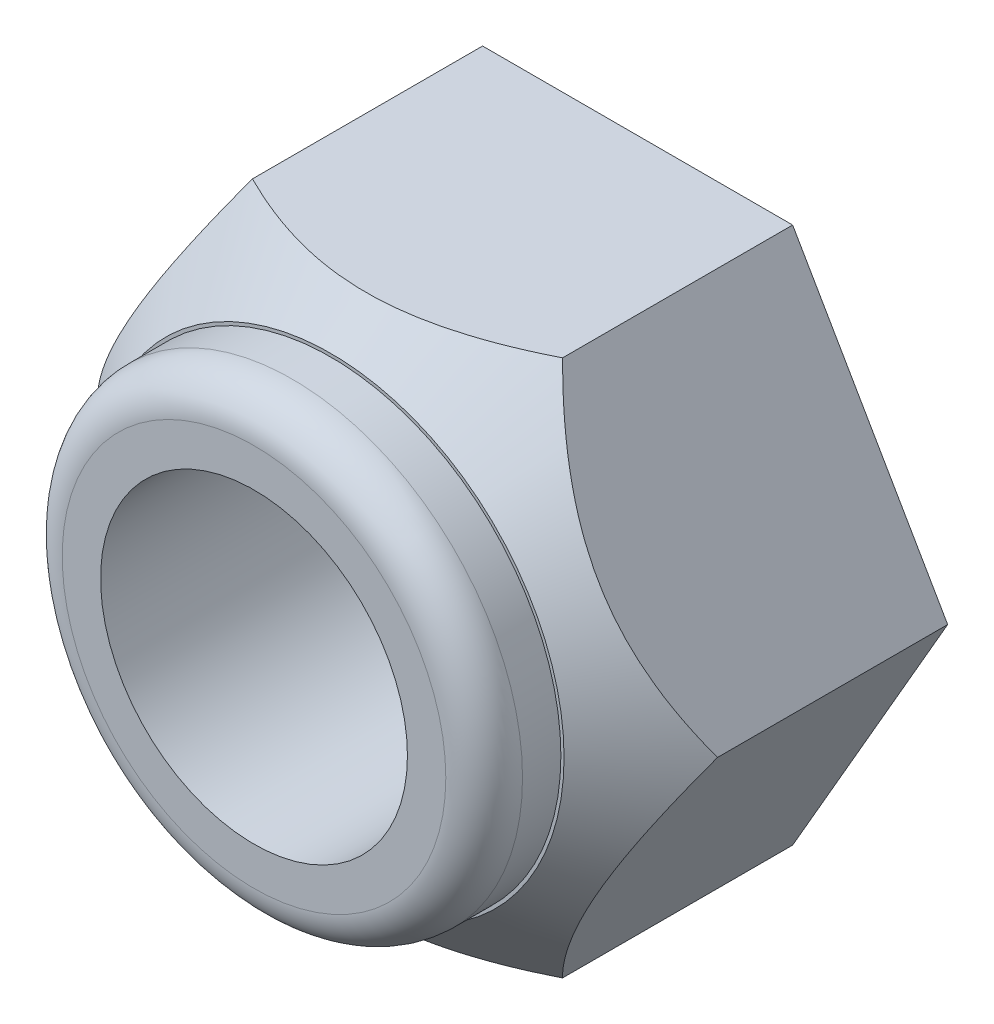
from build123d import *

# Parameters (mm, degrees)
EXTRUDE_1_DEPTH     = 4
SKETCH_2_R          = 3
EXTRUDE_2_DEPTH     = 1
SKETCH_2_3_R        = 2
CUT_EXTRUDE_1_DEPTH = 5.5
FILLET_3_R          = 0.5


with BuildPart() as part:
    # 草图1 → 凸台-拉伸1 (new body)
    with BuildSketch(Plane.XY):
        Polygon((4.041451884, 0), (2.020725942, 3.5), (-2.020725942, 3.5), (-4.041451884, 0), (-2.020725942, -3.5), (2.020725942, -3.5), align=None)
    extrude(amount=EXTRUDE_1_DEPTH)

    # 草图2 → 凸台-拉伸2 (add)
    with BuildSketch(Plane.XY.offset(4)):
        Circle(SKETCH_2_R)
    extrude(amount=EXTRUDE_2_DEPTH)

    # 草图2<3> → 切除-拉伸1 (cut, symmetric)
    with BuildSketch(Plane.XY.offset(4)):
        Circle(SKETCH_2_3_R)
    extrude(amount=CUT_EXTRUDE_1_DEPTH, both=True, mode=Mode.SUBTRACT)

    # 草图3 → 切除-旋转1 (revolve, cut)
    with BuildSketch(Plane(origin=(0, 0, 0), x_dir=(1, 0, 0), z_dir=(0, 1, 0))):
        Polygon((-4.041451884, -4), (-4.041451884, -3), (-3.041451884, -4), align=None)
    revolve(axis=Axis((0, 0, 0), (0, 0, -1)), mode=Mode.SUBTRACT)

    # 圆角3
    fillet_3_edges = [part.edges().sort_by_distance(p)[0] for p in [
        (-3, 0, 5),
    ]]
    fillet(fillet_3_edges, radius=FILLET_3_R)


solid = part.part
